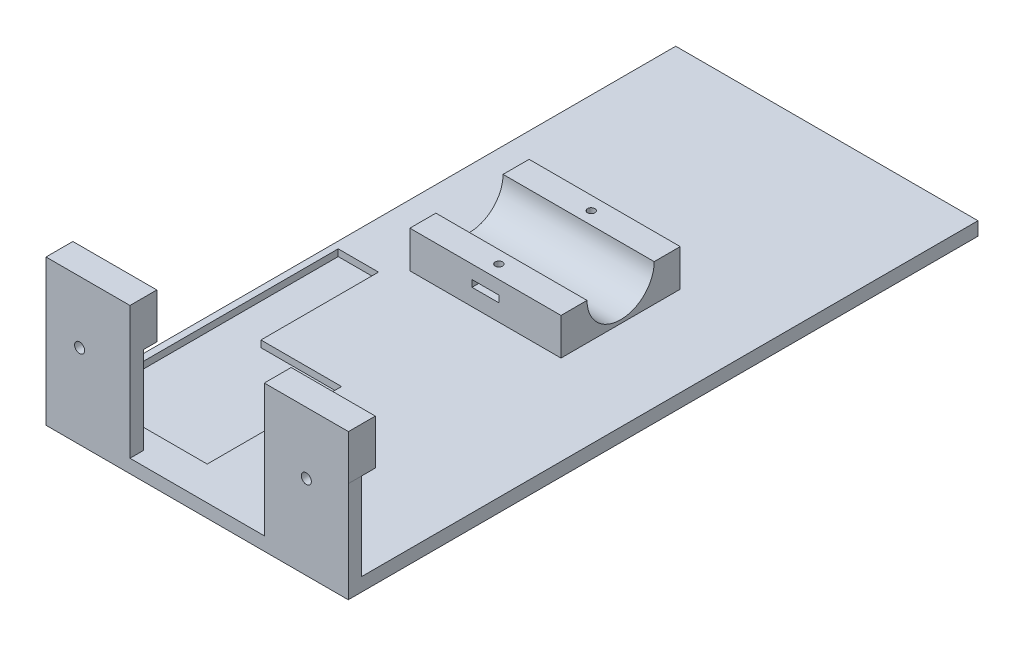
from build123d import *

# Parameters (mm, degrees)
SUPERFICIE_DEITADA_W     = 45
SUPERFICIE_DEITADA_H     = 35.5
BOSS_EXTRUDE1_DEPTH      = 4
SUPERFICIE_DEITADA_4_W   = 45
SUPERFICIE_DEITADA_4_H   = 8
SUPERFICIE_DEITADA_4_H_2 = 19.5
BOSS_EXTRUDE2_DEPTH      = 15
SUPERFICIE_DEITADA_5_W   = 12
SUPERFICIE_DEITADA_5_H   = 35
SUPERFICIE_DEITADA_5_W_2 = 24
SUPERFICIE_DEITADA_5_H_2 = 40
SUPERFICIE_DEITADA_5_R   = 1.1
BOSS_EXTRUDE3_DEPTH      = 2
SUPERFICIE_DEITADA_6_W   = 25
SUPERFICIE_DEITADA_6_H   = 4
BOSS_EXTRUDE4_DEPTH      = 30
SUPERFICIE_DEITADA_7_W   = 25
SUPERFICIE_DEITADA_7_H   = 4
BOSS_EXTRUDE5_DEPTH      = 30
SUPERFICIE_VERTICAL_R    = 1.5
CUT_EXTRUDE1_DEPTH       = 200.4
CUT_EXTRUDE2_DEPTH       = 200.4
SKETCH5_W                = 8
SKETCH5_H                = 2
CUT_EXTRUDE3_DEPTH       = 8
CUT_EXTRUDE4_DEPTH       = 7
CUT_EXTRUDE4_DEPTH_BACK  = 3
SKETCH6_R                = 1.1
SKETCH8_W                = 8
SKETCH8_H                = 2
CUT_EXTRUDE5_DEPTH       = 8
CUT_EXTRUDE6_DEPTH       = 15
CUT_EXTRUDE6_DEPTH_BACK  = 3
SKETCH9_R                = 1.1
SKETCH11_W               = 25.05
SKETCH11_H               = 8
BOSS_EXTRUDE6_DEPTH      = 13.4
SKETCH12_W               = 25
SKETCH12_H               = 8
BOSS_EXTRUDE7_DEPTH      = 13.4


with BuildPart() as part:
    # Superficie_Deitada → Boss-Extrude1 (new body)
    with BuildSketch(Plane(origin=(0, 0, 0), x_dir=(1, 0, 0), z_dir=(0, 1, 0))):
        Polygon((-20, -129.066204139), (-20, -133.066204139), (20, -133.066204139), (20, -129.066204139), (45, -129.066204139), (45, 54.433795861), (-45, 54.433795861), (-45, -129.066204139), align=None)
        with Locations((-4.160854438, -25.316204139)):
            Rectangle(SUPERFICIE_DEITADA_W, SUPERFICIE_DEITADA_H, mode=Mode.SUBTRACT)
        Polygon((-43, -48.066204139), (-31, -48.066204139), (-31, -83.066204139), (-7, -83.066204139), (-7, -123.066204139), (-43, -123.066204139), align=None, mode=Mode.SUBTRACT)
    extrude(amount=BOSS_EXTRUDE1_DEPTH)

    # Superficie_Deitada<4> → Boss-Extrude2 (add)
    with BuildSketch(Plane(origin=(0, 0, 0), x_dir=(1, 0, 0), z_dir=(0, 1, 0))):
        with Locations((-4.160854438, -11.566204139)):
            Rectangle(SUPERFICIE_DEITADA_4_W, SUPERFICIE_DEITADA_4_H)
        with Locations((-4.160854438, -25.316204139)):
            Rectangle(SUPERFICIE_DEITADA_4_W, SUPERFICIE_DEITADA_4_H_2)
        with Locations((-4.160854438, -39.066204139)):
            Rectangle(SUPERFICIE_DEITADA_4_W, SUPERFICIE_DEITADA_4_H)
    extrude(amount=BOSS_EXTRUDE2_DEPTH)

    # Superficie_Deitada<5> → Boss-Extrude3 (add)
    # profile 1 of 3: a face of its own
    with BuildSketch(Plane(origin=(0, 0, 0), x_dir=(1, 0, 0), z_dir=(0, 1, 0))):
        with Locations((-37, -65.566204139)):
            Rectangle(SUPERFICIE_DEITADA_5_W, SUPERFICIE_DEITADA_5_H)
    # profile 2 of 3: a face of its own
    with BuildSketch(Plane(origin=(0, 0, 0), x_dir=(1, 0, 0), z_dir=(0, 1, 0))):
        with Locations((-19, -103.066204139)):
            Rectangle(SUPERFICIE_DEITADA_5_W_2, SUPERFICIE_DEITADA_5_H_2)
        with Locations(Location((-18, -93.066204139, 0), (0, 0, 270))):
            Circle(SUPERFICIE_DEITADA_5_R, mode=Mode.SUBTRACT)
        with Locations(Location((-18, -87.066204139, 0), (0, 0, 270))):
            Circle(SUPERFICIE_DEITADA_5_R, mode=Mode.SUBTRACT)
        with Locations(Location((-12, -93.066204139, 0), (0, 0, 270))):
            Circle(SUPERFICIE_DEITADA_5_R, mode=Mode.SUBTRACT)
        with Locations(Location((-12, -87.066204139, 0), (0, 0, 270))):
            Circle(SUPERFICIE_DEITADA_5_R, mode=Mode.SUBTRACT)
    # profile 3 of 3: a face of its own
    with BuildSketch(Plane(origin=(0, 0, 0), x_dir=(1, 0, 0), z_dir=(0, 1, 0))):
        with Locations((-37, -103.066204139)):
            Rectangle(SUPERFICIE_DEITADA_5_W, SUPERFICIE_DEITADA_5_H_2)
    extrude(amount=BOSS_EXTRUDE3_DEPTH)

    # Superficie_Deitada<6> → Boss-Extrude4 (add)
    with BuildSketch(Plane(origin=(0, 0, 0), x_dir=(1, 0, 0), z_dir=(0, 1, 0))):
        with Locations((32.5, -131.066204139)):
            Rectangle(SUPERFICIE_DEITADA_6_W, SUPERFICIE_DEITADA_6_H)
    extrude(amount=BOSS_EXTRUDE4_DEPTH)

    # Superficie_Deitada<7> → Boss-Extrude5 (add)
    with BuildSketch(Plane(origin=(0, 0, 0), x_dir=(1, 0, 0), z_dir=(0, 1, 0))):
        with Locations((-32.5, -131.066204139)):
            Rectangle(SUPERFICIE_DEITADA_7_W, SUPERFICIE_DEITADA_7_H)
    extrude(amount=BOSS_EXTRUDE5_DEPTH)

    # Superficie_vertical → Cut-Extrude1 (cut)
    with BuildSketch(Plane.XY):
        with Locations(Location((32.5, 25, 0), (0, 0, 180))):
            Circle(SUPERFICIE_VERTICAL_R)
        with Locations(Location((-35, 25, 0), (0, 0, 180))):
            Circle(SUPERFICIE_VERTICAL_R)
    extrude(amount=CUT_EXTRUDE1_DEPTH, mode=Mode.SUBTRACT)

    # Sketch4 → Cut-Extrude2 (cut)
    with BuildSketch(Plane.ZY.offset(26.660854438)):
        with BuildLine():
            ThreePointArc((35.316204139, 15), (25.316204139, 25), (15.316204139, 15))
            Line((15.316204139, 15), (15.566204139, 15))
            Line((15.566204139, 15), (35.066204139, 15))
            Line((35.066204139, 15), (35.316204139, 15))
        make_face()
        with BuildLine():
            Line((15.566204139, 15), (15.316204139, 15))
            ThreePointArc((15.316204139, 15), (25.316204139, 5), (35.316204139, 15))
            Line((35.316204139, 15), (35.066204139, 15))
            Line((35.066204139, 15), (15.566204139, 15))
        make_face()
    extrude(amount=-CUT_EXTRUDE2_DEPTH, mode=Mode.SUBTRACT)

    # Sketch5 → Cut-Extrude3 (cut)
    with BuildSketch(Plane(origin=(0, 0, 7.566204139), x_dir=(-1, 0, 0), z_dir=(0, 0, -1))):
        with Locations((4.160854438, 11)):
            Rectangle(SKETCH5_W, SKETCH5_H)
    extrude(amount=-CUT_EXTRUDE3_DEPTH, mode=Mode.SUBTRACT)

    # Sketch6 → Cut-Extrude4 (cut, two sides: drawn at the far end of the back side and taken through both)
    with BuildSketch(Plane(origin=(0, 10, 0), x_dir=(1, 0, 0), z_dir=(0, 1, 0)).offset(-CUT_EXTRUDE4_DEPTH_BACK)):
        with Locations(Location((-4.160854438, -11.566204139, 0), (0, 0, 270))):
            Circle(SKETCH6_R)
    extrude(amount=CUT_EXTRUDE4_DEPTH + CUT_EXTRUDE4_DEPTH_BACK, mode=Mode.SUBTRACT)

    # Sketch8 → Cut-Extrude5 (cut)
    with BuildSketch(Plane.XY.offset(43.066204139)):
        with Locations((-4.160854438, 10)):
            Rectangle(SKETCH8_W, SKETCH8_H)
    extrude(amount=-CUT_EXTRUDE5_DEPTH, mode=Mode.SUBTRACT)

    # Sketch9 → Cut-Extrude6 (cut, two sides: drawn at the far end of the back side and taken through both)
    with BuildSketch(Plane(origin=(0, 9, 0), x_dir=(1, 0, 0), z_dir=(0, 1, 0)).offset(-CUT_EXTRUDE6_DEPTH_BACK)):
        with Locations(Location((-4.160854438, -39.066204139, 0), (0, 0, 270))):
            Circle(SKETCH9_R)
    extrude(amount=CUT_EXTRUDE6_DEPTH + CUT_EXTRUDE6_DEPTH_BACK, mode=Mode.SUBTRACT)

    # Sketch11 → Boss-Extrude6 (add)
    with BuildSketch(Plane(origin=(0, 30, 0), x_dir=(1, 0, 0), z_dir=(0, 1, 0))):
        with Locations((32.525, -129.066204139)):
            Rectangle(SKETCH11_W, SKETCH11_H)
    extrude(amount=BOSS_EXTRUDE6_DEPTH)

    # Sketch12 → Boss-Extrude7 (add)
    with BuildSketch(Plane(origin=(0, 30, 0), x_dir=(1, 0, 0), z_dir=(0, 1, 0))):
        with Locations((-32.5, -129.066204139)):
            Rectangle(SKETCH12_W, SKETCH12_H)
    extrude(amount=BOSS_EXTRUDE7_DEPTH)


solid = part.part
